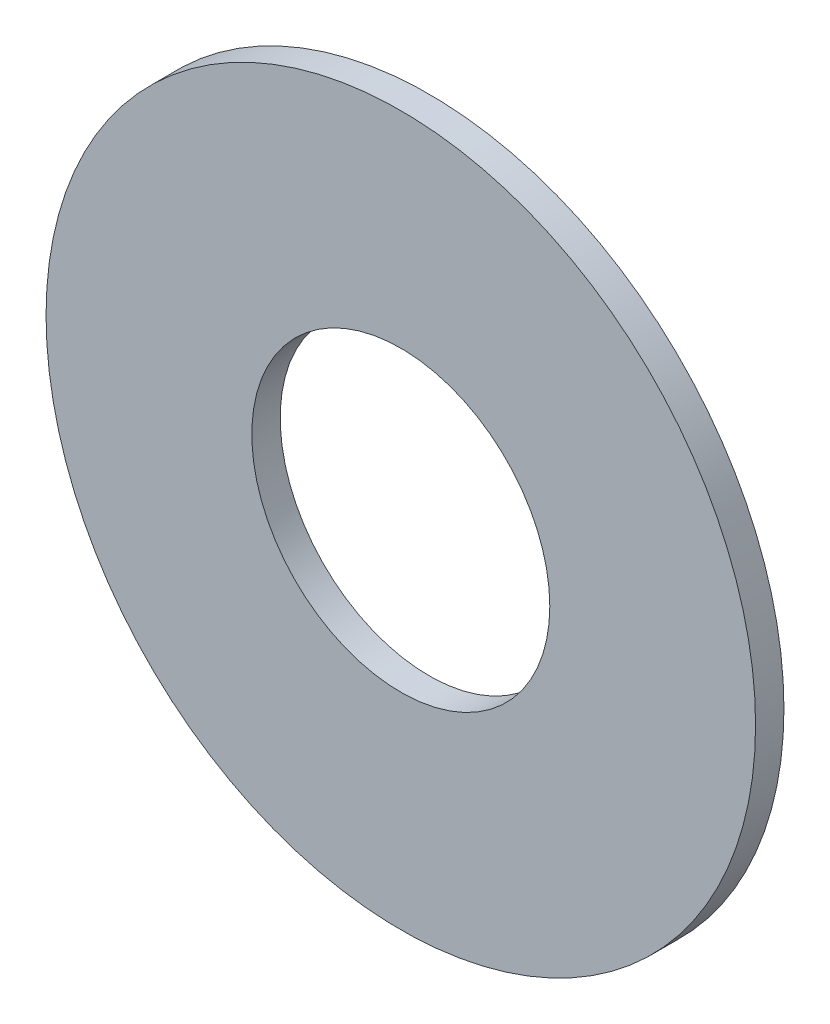
from build123d import *

# Parameters (mm, degrees)
GASKETSKE_R   = 2.5
GASKETSKE_R_2 = 1.05
GASKET_DEPTH  = 0.2


with BuildPart() as part:
    # GasketSke → Gasket (new body)
    with BuildSketch(Plane.XY):
        Circle(GASKETSKE_R)
        Circle(GASKETSKE_R_2, mode=Mode.SUBTRACT)
    extrude(amount=GASKET_DEPTH)


solid = part.part
